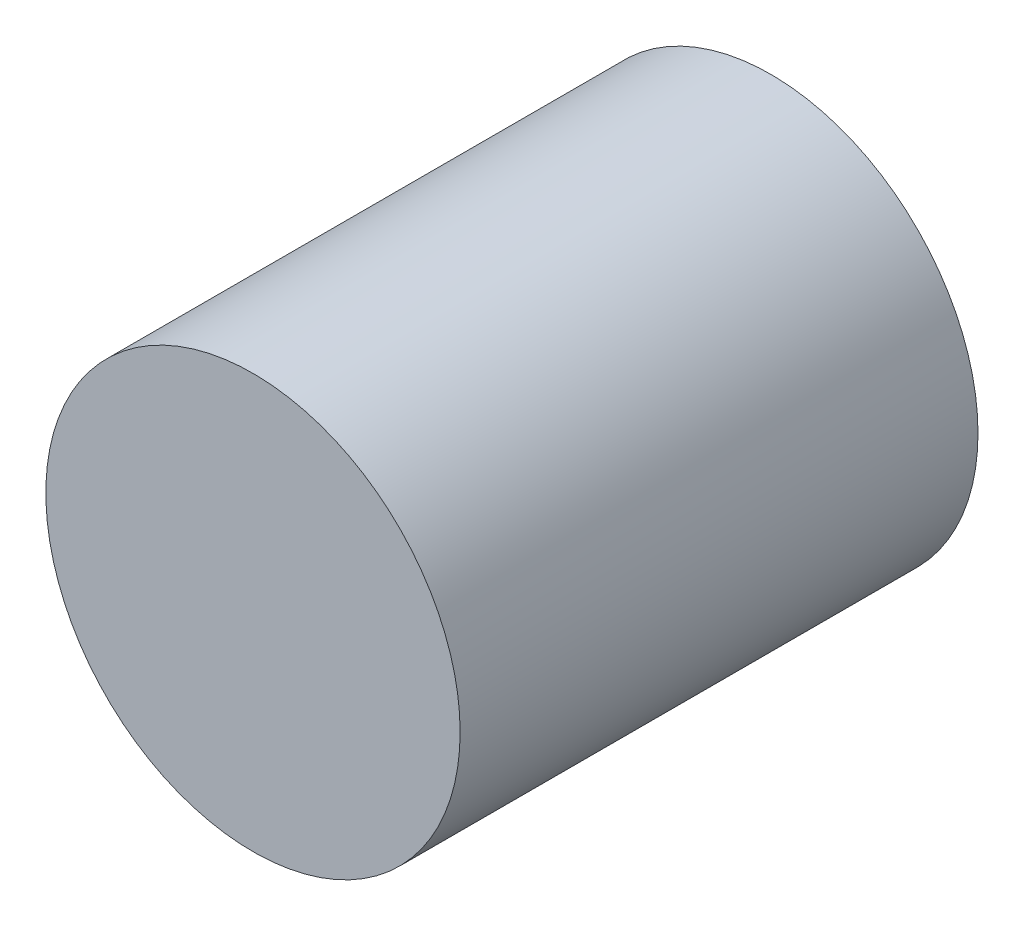
from build123d import *

# Parameters (mm, degrees)
SKETCH_1_R      = 200
EXTRUDE_1_DEPTH = 500


with BuildPart() as part:
    # ｽｹｯﾁ1 → ﾎﾞｽ - 押し出し1 (new body)
    with BuildSketch(Plane.XY):
        Circle(SKETCH_1_R)
    extrude(amount=EXTRUDE_1_DEPTH)


solid = part.part
